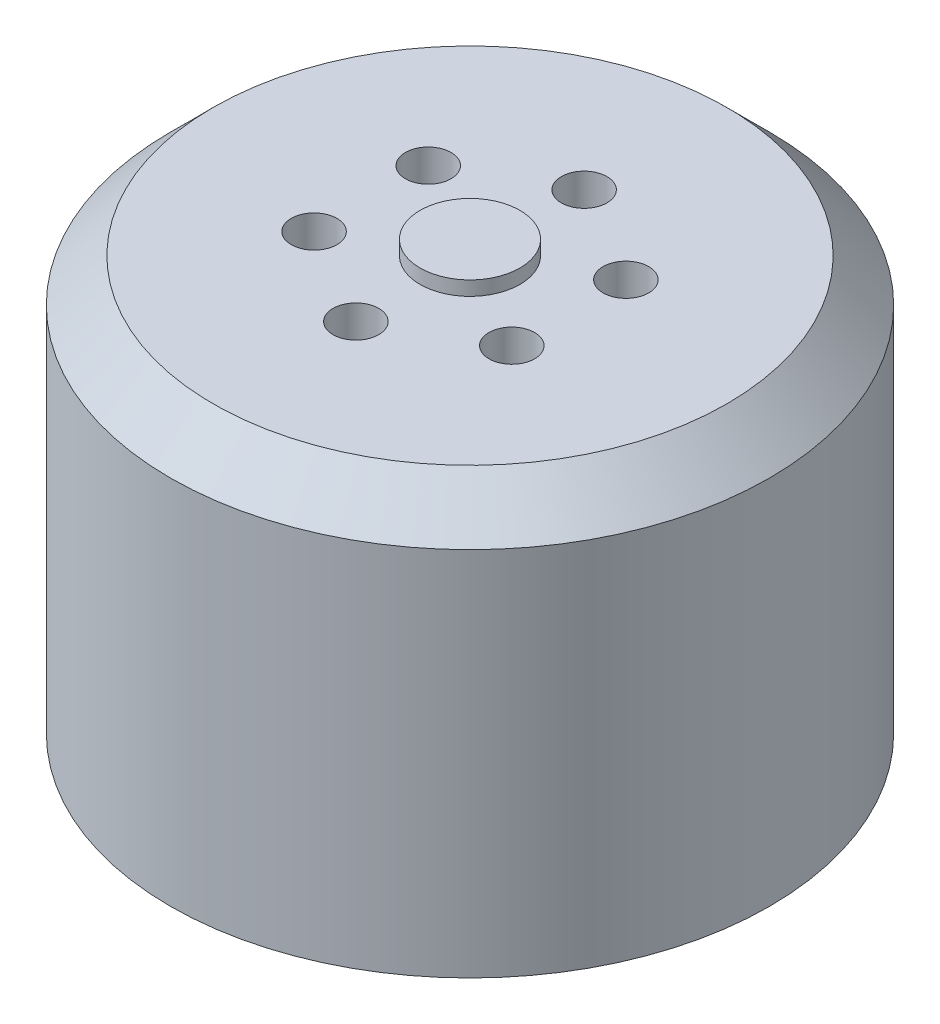
from build123d import *

# Parameters (mm, degrees)
SKETCH_5_R          = 1.6
CUT_EXTRUDE_1_DEPTH = 5
SKETCH_6_R          = 1.6
CUT_EXTRUDE_2_DEPTH = 5
SKETCH_7_R          = 3.5
EXTRUDE_1_DEPTH     = 1


with BuildPart() as part:
    # 草图4 → 旋转1 (revolve)
    with BuildSketch(Plane.XY, mode=Mode.PRIVATE) as revolve_1_sk:
        Polygon((0, 30.5), (-18, 30.5), (-21, 27.5), (-21, 1.5), (-10, 1.5), (-10, 0), (0, 0), align=None)
    revolve(revolve_1_sk.sketch.rotate(Axis((0, 0, 0), (0, 1, 0)), 180), axis=Axis((0, 0, 0), (0, 1, 0)))

    # 草图5 → 切除-拉伸1 (cut)
    with BuildSketch(Plane(origin=(0, 30.5, 0), x_dir=(1, 0, 0), z_dir=(0, 1, 0))):
        with Locations(Location((0, 8, 0), (0, 0, 270))):
            Circle(SKETCH_5_R)
        with Locations(Location((6.92820323, 4, 0), (0, 0, 270))):
            Circle(SKETCH_5_R)
        with Locations(Location((6.92820323, -4, 0), (0, 0, 270))):
            Circle(SKETCH_5_R)
        with Locations(Location((0, -8, 0), (0, 0, 270))):
            Circle(SKETCH_5_R)
        with Locations(Location((-6.92820323, -4, 0), (0, 0, 270))):
            Circle(SKETCH_5_R)
        with Locations(Location((-6.92820323, 4, 0), (0, 0, 270))):
            Circle(SKETCH_5_R)
    extrude(amount=-CUT_EXTRUDE_1_DEPTH, mode=Mode.SUBTRACT)

    # 草图6 → 切除-拉伸2 (cut)
    with BuildSketch(Plane.XZ.offset(-1.5)):
        with Locations(Location((0, 18, 0), (0, 0, 270))):
            Circle(SKETCH_6_R)
        with Locations(Location((18, 0, 0), (0, 0, 270))):
            Circle(SKETCH_6_R)
        with Locations(Location((0, -18, 0), (0, 0, 270))):
            Circle(SKETCH_6_R)
        with Locations(Location((-18, 0, 0), (0, 0, 270))):
            Circle(SKETCH_6_R)
    extrude(amount=-CUT_EXTRUDE_2_DEPTH, mode=Mode.SUBTRACT)

    # 草图7 → 凸台-拉伸1 (add)
    with BuildSketch(Plane(origin=(0, 30.5, 0), x_dir=(1, 0, 0), z_dir=(0, 1, 0))):
        Circle(SKETCH_7_R)
    extrude(amount=EXTRUDE_1_DEPTH)


solid = part.part
